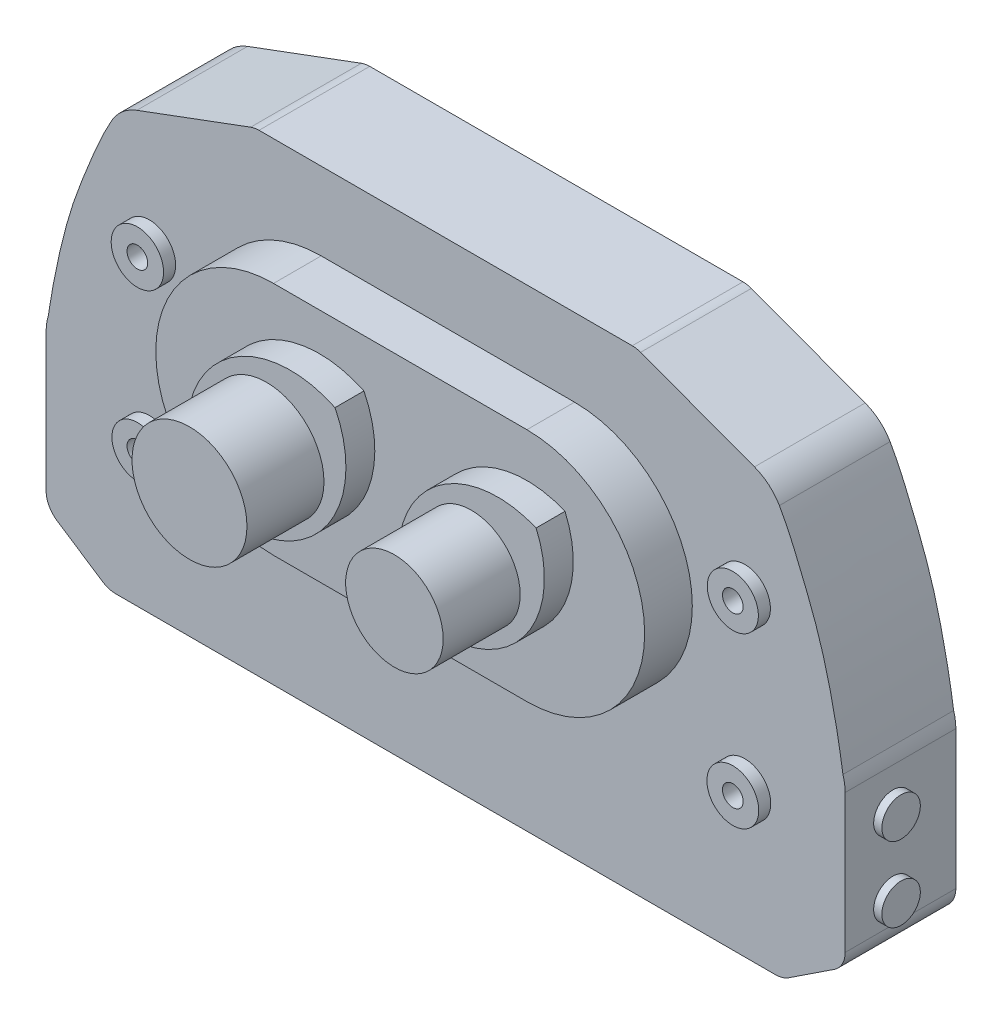
from build123d import *

# Parameters (mm, degrees)
BOSS_EXTRUDE1_DEPTH = 23
SKETCH5_R           = 4
BOSS_EXTRUDE3_DEPTH = 1.7
SKETCH8_R           = 4
BOSS_EXTRUDE4_DEPTH = 1.7
SKETCH12_R          = 5.309585237
SKETCH12_R_2        = 5.383577716
SKETCH12_R_3        = 5.290961271
SKETCH12_R_4        = 5.444301549
BOSS_EXTRUDE5_DEPTH = 9.9
BOSS_EXTRUDE6_DEPTH = 22
CUT_EXTRUDE1_START  = -16
SKETCH16_R          = 11.94
CUT_EXTRUDE1_DEPTH  = 16
CUT_EXTRUDE2_START  = -16
SKETCH17_R          = 10.13
CUT_EXTRUDE2_DEPTH  = 16
CUT_EXTRUDE3_START  = -7.4
SKETCH18_R          = 5.309585237
CUT_EXTRUDE3_DEPTH  = 7.4
CUT_EXTRUDE4_START  = -7.4
SKETCH19_R          = 5.383577716
CUT_EXTRUDE4_DEPTH  = 7.4
CUT_EXTRUDE5_START  = -7.4
SKETCH20_R          = 5.444301549
CUT_EXTRUDE5_DEPTH  = 7.4
CUT_EXTRUDE6_START  = -7.4
SKETCH21_R          = 5.290961271
CUT_EXTRUDE6_DEPTH  = 7.4
SKETCH22_R          = 2.15
CUT_EXTRUDE7_DEPTH  = 10


with BuildPart() as part:
    # Sketch2 → Boss-Extrude1 (new body)
    with BuildSketch(Plane.XY):
        with BuildLine():
            Line((70.523413182, -121.258597495), (80.001788964, -115.008475165))
            ThreePointArc((80.001788964, -115.008475165), (81.651709385, -113.204688447), (82.249297777, -110.834293536))
            Line((82.249297777, -110.834293536), (82.249297777, -82.060728072))
            ThreePointArc((82.249297777, -82.060728072), (82.132627635, -80.537642087), (81.785339594, -79.050095835))
            add(Edge.make_bspline(
                [(81.785339594, -79.050095835), (81.779550585, -79.03175941), (79.763594577, -64.21980724), (72.310783114, -44.632084365), (70.089271073, -39.87053002), (68.584818962, -37.26596578)],
                knots=[0.01010668, 0.01010668, 0.01010668, 0.01010668, 0.430228508, 0.512694162, 0.834763224, 0.834763224, 0.834763224, 0.834763224], degree=3))
            ThreePointArc((68.584818962, -37.26596578), (66.377835563, -34.627803803), (63.407507036, -32.893496223))
            Line((63.407507036, -32.893496223), (39.759590264, -24.109812278))
            ThreePointArc((39.759590264, -24.109812278), (38.90305511, -23.875770322), (38.018627658, -23.796927511))
            Line((38.018627658, -23.796927511), (-39.520032104, -23.796927511))
            ThreePointArc((-39.520032104, -23.796927511), (-40.404459556, -23.875770322), (-41.26099471, -24.109812278))
            Line((-41.26099471, -24.109812278), (-64.908911482, -32.893496223))
            ThreePointArc((-64.908911482, -32.893496223), (-67.879240009, -34.627803803), (-70.086223408, -37.26596578))
            add(Edge.make_bspline(
                [(-83.28674404, -79.050095835), (-83.280955031, -79.03175941), (-81.264999023, -64.21980724), (-73.81218756, -44.632084365), (-71.590675519, -39.87053002), (-70.086223408, -37.26596578)],
                knots=[0.01010668, 0.01010668, 0.01010668, 0.01010668, 0.430228508, 0.512694162, 0.834763224, 0.834763224, 0.834763224, 0.834763224], degree=3))
            ThreePointArc((-83.28674404, -79.050095835), (-83.634032081, -80.537642087), (-83.750702223, -82.060728072))
            Line((-83.750702223, -82.060728072), (-83.750702223, -110.834293536))
            ThreePointArc((-83.750702223, -110.834293536), (-83.153113831, -113.204688447), (-81.50319341, -115.008475165))
            Line((-81.50319341, -115.008475165), (-72.024817629, -121.258597495))
            ThreePointArc((-72.024817629, -121.258597495), (-70.709179228, -121.873513284), (-69.272326442, -122.084415867))
            Line((-69.272326442, -122.084415867), (67.770921996, -122.084415867))
            ThreePointArc((67.770921996, -122.084415867), (69.207774782, -121.873513284), (70.523413182, -121.258597495))
        make_face()
    extrude(amount=BOSS_EXTRUDE1_DEPTH)

    # Sketch5 → Boss-Extrude3 (add)
    with BuildSketch(Plane.ZY.offset(83.750702223)):
        with Locations(Location((13.083649818, -90.551709518, 0), (0, 0, 90))):
            Circle(SKETCH5_R)
        with Locations(Location((13.083649818, -106.069633318, 0), (0, 0, 90))):
            Circle(SKETCH5_R)
    extrude(amount=BOSS_EXTRUDE3_DEPTH)

    # Sketch8 → Boss-Extrude4 (add)
    with BuildSketch(Plane(origin=(82.249297777, 0, 0), x_dir=(0, 0, -1), z_dir=(1, 0, 0))):
        with Locations(Location((-13.08, -90.550728072, 0), (0, 0, 270))):
            Circle(SKETCH8_R)
        with Locations(Location((-13.08, -106.070728072, 0), (0, 0, 270))):
            Circle(SKETCH8_R)
    extrude(amount=BOSS_EXTRUDE4_DEPTH)

    # Sketch12 → Boss-Extrude5 (add)
    with BuildSketch(Plane.XY.offset(23)):
        with Locations(Location((61.412858859, -56.74856372, 0), (0, 0, 180))):
            Circle(SKETCH12_R)
        with Locations(Location((61.412858859, -91.784557501, 0), (0, 0, 180))):
            Circle(SKETCH12_R_2)
        with Locations(Location((-62.293922582, -91.784557501, 0), (0, 0, 180))):
            Circle(SKETCH12_R_3)
        with Locations(Location((-62.293922582, -56.74856372, 0), (0, 0, 180))):
            Circle(SKETCH12_R_4)
        with BuildLine():
            Line((26.03317791, -39.941081705), (-26.605656617, -39.941081705))
            ThreePointArc((-26.605656617, -39.941081705), (-51.069934746, -64.405359834), (-26.605656617, -88.869637962))
            Line((-26.605656617, -88.869637962), (26.03317791, -88.869637962))
            ThreePointArc((26.03317791, -88.869637962), (50.497456038, -64.405359834), (26.03317791, -39.941081705))
        make_face()
    extrude(amount=BOSS_EXTRUDE5_DEPTH)

    # Sketch15 → Boss-Extrude6 (add)
    with BuildSketch(Plane.XY.offset(32.9)):
        with BuildLine():
            ThreePointArc((-36.30694092, -78.897586955), (-32.416918561, -54.237740907), (-7.831564022, -49.901772358))
            ThreePointArc((-7.831564022, -49.901772358), (-11.721586381, -74.561618406), (-36.30694092, -78.897586955))
        make_face()
        with BuildLine():
            ThreePointArc((33.947027157, -50.665986501), (29.727203797, -73.404384895), (7.056950152, -77.976175614))
            ThreePointArc((7.056950152, -77.976175614), (11.276773512, -55.23777722), (33.947027157, -50.665986501))
        make_face()
    extrude(amount=BOSS_EXTRUDE6_DEPTH)

    # Sketch16 → Cut-Extrude1 (cut)
    with BuildSketch(Plane.XY.offset(54.9).offset(CUT_EXTRUDE1_START)):
        with BuildLine():
            ThreePointArc((-36.30694092, -78.897586955), (-32.416918561, -54.237740907), (-7.831564022, -49.901772358))
            ThreePointArc((-7.831564022, -49.901772358), (-11.721586381, -74.561618406), (-36.30694092, -78.897586955))
        make_face()
        with Locations((-22.069252471, -64.399679657)):
            Circle(SKETCH16_R, mode=Mode.SUBTRACT)
    extrude(amount=CUT_EXTRUDE1_DEPTH, mode=Mode.SUBTRACT)

    # Sketch17 → Cut-Extrude2 (cut)
    with BuildSketch(Plane.XY.offset(54.9).offset(CUT_EXTRUDE2_START)):
        with BuildLine():
            ThreePointArc((7.056950152, -77.976175614), (11.276773512, -55.23777722), (33.947027157, -50.665986501))
            ThreePointArc((33.947027157, -50.665986501), (29.727203797, -73.404384895), (7.056950152, -77.976175614))
        make_face()
        with Locations((20.501988655, -64.321081058)):
            Circle(SKETCH17_R, mode=Mode.SUBTRACT)
    extrude(amount=CUT_EXTRUDE2_DEPTH, mode=Mode.SUBTRACT)

    # Sketch18 → Cut-Extrude3 (cut)
    with BuildSketch(Plane.XY.offset(32.9).offset(CUT_EXTRUDE3_START)):
        with Locations(Location((61.412858859, -56.74856372, 0), (0, 0, 180))):
            Circle(SKETCH18_R)
    extrude(amount=CUT_EXTRUDE3_DEPTH, mode=Mode.SUBTRACT)

    # Sketch19 → Cut-Extrude4 (cut)
    with BuildSketch(Plane.XY.offset(32.9).offset(CUT_EXTRUDE4_START)):
        with Locations(Location((61.412858859, -91.784557501, 0), (0, 0, 180))):
            Circle(SKETCH19_R)
    extrude(amount=CUT_EXTRUDE4_DEPTH, mode=Mode.SUBTRACT)

    # Sketch20 → Cut-Extrude5 (cut)
    with BuildSketch(Plane.XY.offset(32.9).offset(CUT_EXTRUDE5_START)):
        with Locations(Location((-62.293922582, -56.74856372, 0), (0, 0, 180))):
            Circle(SKETCH20_R)
    extrude(amount=CUT_EXTRUDE5_DEPTH, mode=Mode.SUBTRACT)

    # Sketch21 → Cut-Extrude6 (cut)
    with BuildSketch(Plane.XY.offset(32.9).offset(CUT_EXTRUDE6_START)):
        with Locations(Location((-62.293922582, -91.784557501, 0), (0, 0, 180))):
            Circle(SKETCH21_R)
    extrude(amount=CUT_EXTRUDE6_DEPTH, mode=Mode.SUBTRACT)

    # Sketch22 → Cut-Extrude7 (cut)
    with BuildSketch(Plane.XY.offset(25.5)):
        with Locations((-62.293922582, -56.74856372)):
            Circle(SKETCH22_R)
        with Locations((-62.293922582, -91.784557501)):
            Circle(SKETCH22_R)
        with Locations((61.412858859, -91.784557501)):
            Circle(SKETCH22_R)
        with Locations((61.412858859, -56.74856372)):
            Circle(SKETCH22_R)
    extrude(amount=-CUT_EXTRUDE7_DEPTH, mode=Mode.SUBTRACT)


solid = part.part
